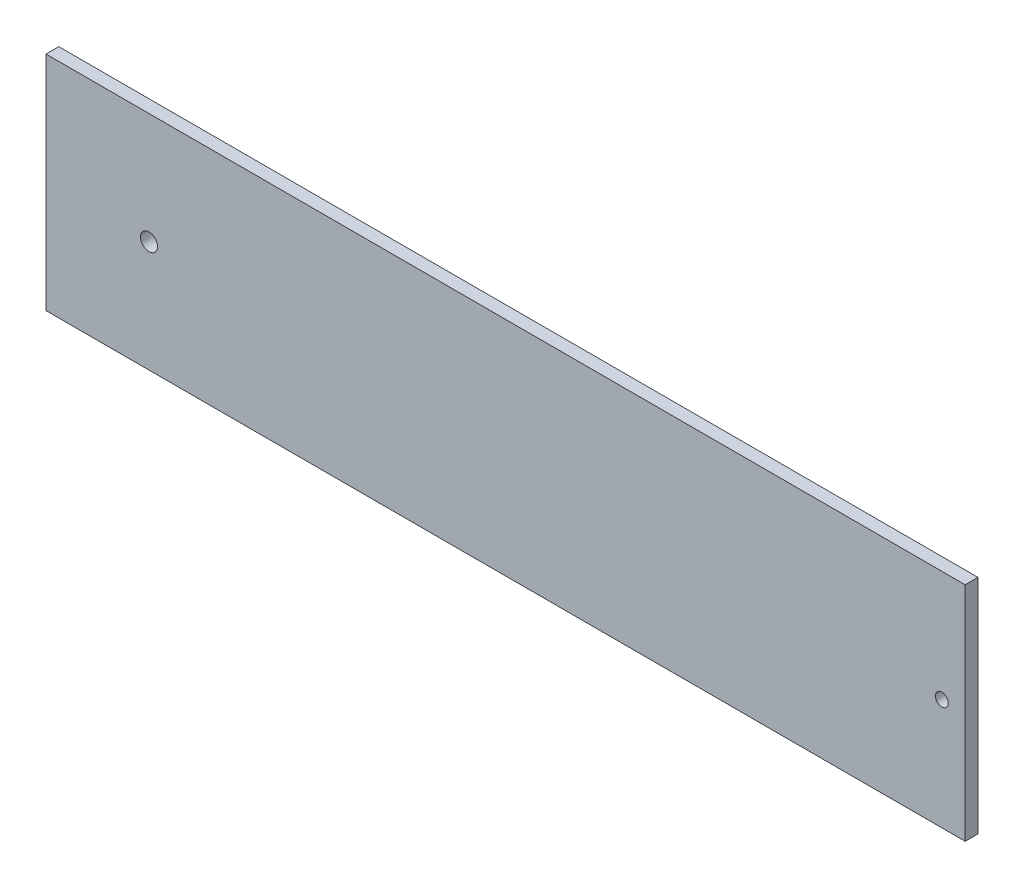
from build123d import *

# Parameters (mm, degrees)
SKETCH1_W           = 241.3
SKETCH1_H           = 52.07
BOSS_EXTRUDE1_DEPTH = 3
SKETCH2_R           = 2
CUT_EXTRUDE1_DEPTH  = 124.463531964
SKETCH7_R           = 1.5
CUT_EXTRUDE3_DEPTH  = 124.463531964
SKETCH8_W           = 3
SKETCH8_H           = 52.07
CUT_EXTRUDE4_DEPTH  = 25.908


with BuildPart() as part:
    # Sketch1 → Boss-Extrude1 (new body)
    with BuildSketch(Plane.XY):
        Rectangle(SKETCH1_W, SKETCH1_H)
    extrude(amount=BOSS_EXTRUDE1_DEPTH)

    # Sketch2 → Cut-Extrude1 (cut, through all)
    with BuildSketch(Plane.XY.offset(3)):
        with Locations((113.339406907, 0)):
            Circle(SKETCH2_R)
        with Locations((-96.52, 0)):
            Circle(SKETCH2_R)
    extrude(amount=-CUT_EXTRUDE1_DEPTH, mode=Mode.SUBTRACT)

    # Sketch7 → Cut-Extrude3 (cut, through all)
    with BuildSketch(Plane.XY.offset(3)):
        with Locations((89.267430612, 0)):
            Circle(SKETCH7_R)
    extrude(amount=-CUT_EXTRUDE3_DEPTH, mode=Mode.SUBTRACT)

    # Sketch8 → Cut-Extrude4 (cut)
    with BuildSketch(Plane(origin=(120.65, 0, 0), x_dir=(0, 0, -1), z_dir=(1, 0, 0))):
        with Locations((-1.5, 0)):
            Rectangle(SKETCH8_W, SKETCH8_H)
    extrude(amount=-CUT_EXTRUDE4_DEPTH, mode=Mode.SUBTRACT)


solid = part.part
